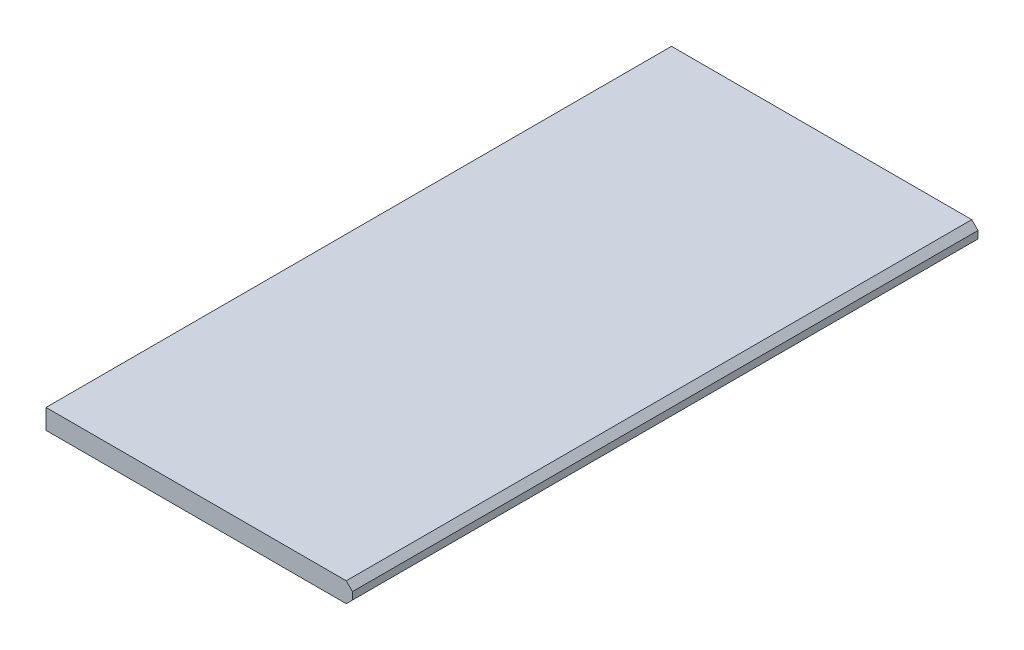
from build123d import *

# Parameters (mm, degrees)
SKETCH1_W           = 24.5
SKETCH1_H           = 1.5875
BOSS_EXTRUDE1_DEPTH = 50
CHAMFER1_SIZE       = 0.5


with BuildPart() as part:
    # Sketch1 → Boss-Extrude1 (new body)
    with BuildSketch(Plane.XY):
        Rectangle(SKETCH1_W, SKETCH1_H)
    extrude(amount=BOSS_EXTRUDE1_DEPTH)

    # Chamfer1
    chamfer1_edges = [part.edges().sort_by_distance(p)[0] for p in [
        (12.25, -0.79375, 25),
        (12.25, 0.79375, 25),
    ]]
    chamfer(chamfer1_edges, length=CHAMFER1_SIZE)


solid = part.part
